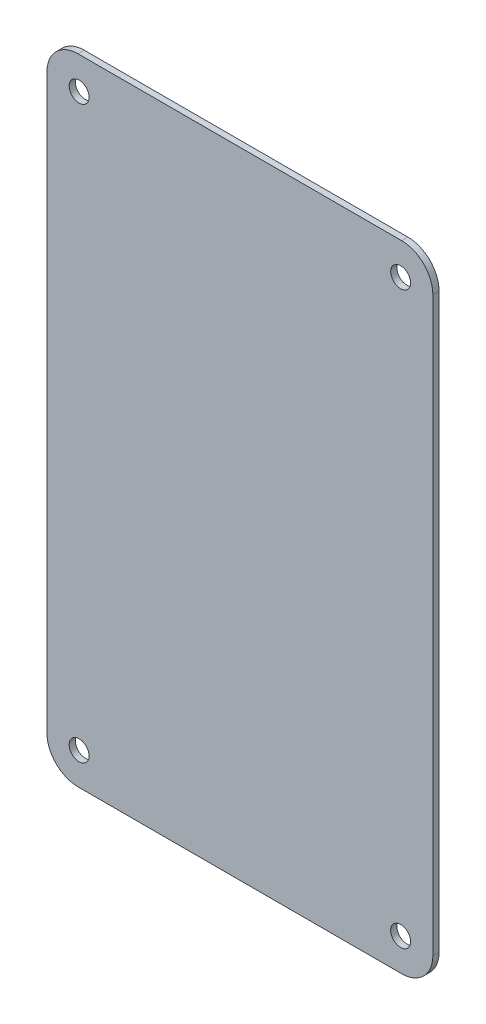
from build123d import *

# Parameters (mm, degrees)
BOSS_EXTRU_1_DEPTH           = 1
ENL_V_MAT_EXTRU_1_DEPTH      = 144.780695976
ENL_V_MAT_EXTRU_1_DEPTH_BACK = 144.780695976
ESQUISSE2_R                  = 1.6


with BuildPart() as part:
    # Esquisse1 → Boss.-Extru.1 (new body)
    with BuildSketch(Plane.XY):
        with BuildLine():
            Line((26.971910928, 14.707354998), (78.971910928, 14.707354998))
            ThreePointArc((78.971910928, 14.707354998), (82.507444834, 16.171821092), (83.971910928, 19.707354998))
            Line((83.971910928, 19.707354998), (83.971910928, 111.707354998))
            ThreePointArc((83.971910928, 111.707354998), (82.507444834, 115.242888904), (78.971910928, 116.707354998))
            Line((78.971910928, 116.707354998), (26.971910928, 116.707354998))
            ThreePointArc((26.971910928, 116.707354998), (23.436377022, 115.242888904), (21.971910928, 111.707354998))
            Line((21.971910928, 111.707354998), (21.971910928, 19.707354998))
            ThreePointArc((21.971910928, 19.707354998), (23.436377022, 16.171821092), (26.971910928, 14.707354998))
        make_face()
    extrude(amount=BOSS_EXTRU_1_DEPTH)

    # Esquisse2 → Enlèv. mat.-Extru.1 (cut, two sides: drawn at the far end of the back side and taken through both)
    with BuildSketch(Plane.XY.offset(1).offset(-ENL_V_MAT_EXTRU_1_DEPTH_BACK)):
        with Locations((27.143483803, 19.878927873)):
            Circle(ESQUISSE2_R)
        with Locations((78.800338052, 19.878927873)):
            Circle(ESQUISSE2_R)
        with Locations((27.143483803, 111.535782123)):
            Circle(ESQUISSE2_R)
        with Locations((78.800338052, 111.535782123)):
            Circle(ESQUISSE2_R)
    extrude(amount=ENL_V_MAT_EXTRU_1_DEPTH + ENL_V_MAT_EXTRU_1_DEPTH_BACK, mode=Mode.SUBTRACT)


solid = part.part
